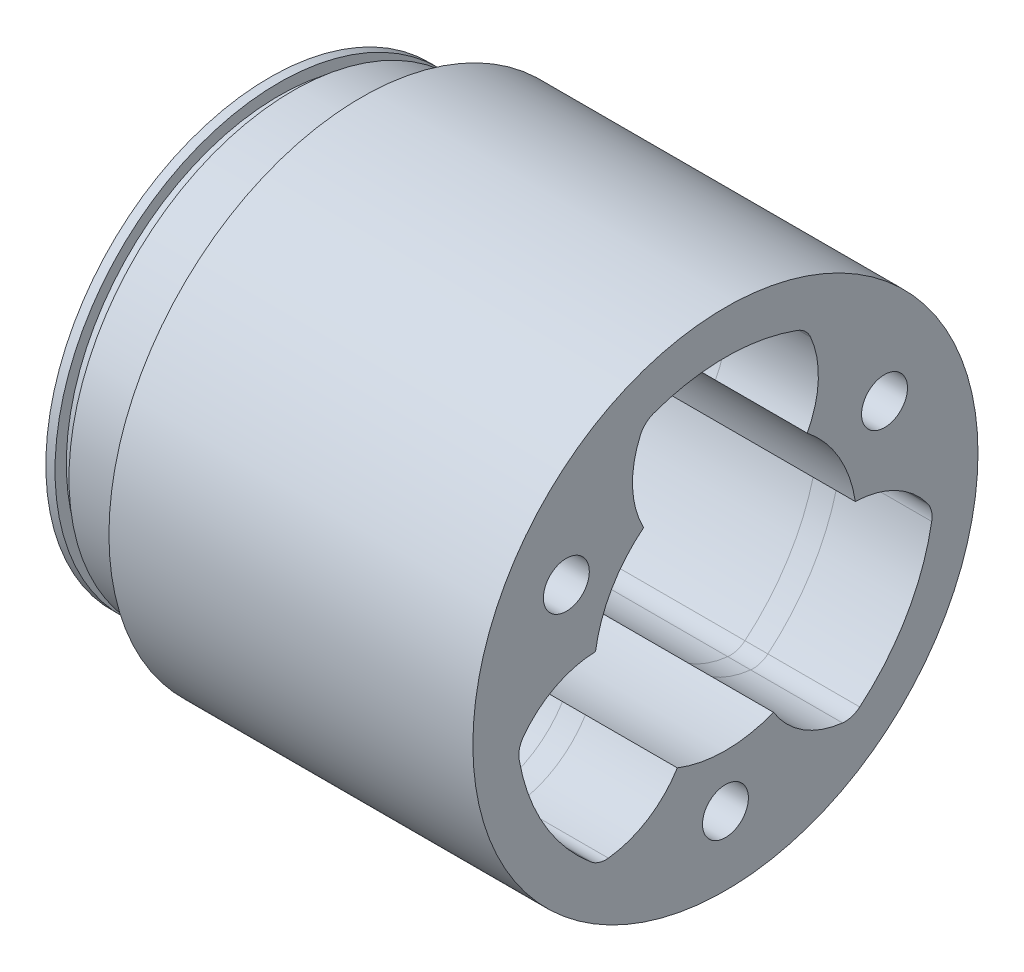
from build123d import *

# Parameters (mm, degrees)
SKETCH4_R                  = 34.925
SKETCH4_R_2                = 18.161
BOSS_EXTRUDE1_DEPTH        = 72.771
CUT_EXTRUDE2_REACH         = 137.172
CUT_EXTRUDE2_START         = 21.75002
TRIPOD_WALLS_R             = 3.175
SKETCH12_R                 = 3.175
CUT_EXTRUDE3_DEPTH         = 63.5
CUT_EXTRUDE4_START         = -22.44598
SKETCH13_R                 = 34.925
CUT_EXTRUDE4_DEPTH         = 22.44598
SKETCH16_R                 = 22.86
COMPENSATING_SPACING_DEPTH = 1.016
F_1_4_0_2500_DOWEL_HOLE1_D = 6.35
BOLT_CIRCLE_PATTERN_2_R    = 4.1021
F_5_16_CLEARNCE_DEPTH      = 13.716


with BuildPart() as part:
    # Sketch2 → Revolve1 (revolve)
    with BuildSketch(Plane.XY, mode=Mode.PRIVATE) as revolve1_sk:
        Polygon((0, 0), (0, -30.9499), (12.7, -30.9499), (12.7, 0), (3.2004, 0), (3.2004, -1.5621), (1.27, -1.5621), (1.27, 0), align=None)
    revolve(revolve1_sk.sketch.rotate(Axis((11.964521893, -30.9499, 0), (-1, 0, 0)), 90), axis=Axis((11.964521893, -30.9499, 0), (-1, 0, 0)))

    # Sketch4 → Boss-Extrude1 (add)
    with BuildSketch(Plane(origin=(12.7, 0, 0), x_dir=(0, 0, -1), z_dir=(1, 0, 0))):
        with Locations((0, -30.9499)):
            Circle(SKETCH4_R)
        with Locations((0, -30.9499)):
            Circle(SKETCH4_R_2, mode=Mode.SUBTRACT)
    extrude(amount=BOSS_EXTRUDE1_DEPTH)

    # Sketch5 → Cut-Extrude2 (cut, up to next)
    with BuildSketch(Plane(origin=(0, 0, 0), x_dir=(0, 0, -1), z_dir=(1, 0, 0)).offset(CUT_EXTRUDE2_START), mode=Mode.PRIVATE) as cut_extrude2_sk1:
        with BuildLine():
            ThreePointArc((-11.141810341, -4.2233215), (0, -23.4823), (11.141810341, -4.2233215))
            ThreePointArc((11.141810341, -4.2233215), (0, -1.9939), (-11.141810341, -4.2233215))
        make_face()
    cut_extrude2_tool1 = extrude(cut_extrude2_sk1.sketch, amount=CUT_EXTRUDE2_REACH, mode=Mode.PRIVATE) & part.part
    # Sketch5 → Cut-Extrude2 (cut, up to next)
    with BuildSketch(Plane(origin=(0, 0, 0), x_dir=(0, 0, -1), z_dir=(1, 0, 0)).offset(CUT_EXTRUDE2_START), mode=Mode.PRIVATE) as cut_extrude2_sk2:
        with BuildLine():
            ThreePointArc((-28.716801071, -34.664098733), (-25.076631449, -45.427900247), (-17.57499054, -53.962280223))
            ThreePointArc((-17.57499054, -53.962280223), (-6.467131268, -34.683700064), (-28.716801071, -34.664098733))
        make_face()
    cut_extrude2_tool2 = extrude(cut_extrude2_sk2.sketch, amount=CUT_EXTRUDE2_REACH, mode=Mode.PRIVATE) & part.part
    # Sketch5 → Cut-Extrude2 (cut, up to next)
    with BuildSketch(Plane(origin=(0, 0, 0), x_dir=(0, 0, -1), z_dir=(1, 0, 0)).offset(CUT_EXTRUDE2_START), mode=Mode.PRIVATE) as cut_extrude2_sk3:
        with BuildLine():
            ThreePointArc((28.716801071, -34.664098733), (6.467131268, -34.683700064), (17.57499054, -53.962280223))
            ThreePointArc((17.57499054, -53.962280223), (25.076631449, -45.427900247), (28.716801071, -34.664098733))
        make_face()
    cut_extrude2_tool3 = extrude(cut_extrude2_sk3.sketch, amount=CUT_EXTRUDE2_REACH, mode=Mode.PRIVATE) & part.part
    add(cut_extrude2_tool1.solids().sort_by_distance((21.75002, -12.135894, 0))[0], mode=Mode.SUBTRACT)
    add(cut_extrude2_tool2.solids().sort_by_distance((21.75002, -40.356903, 16.293407))[0], mode=Mode.SUBTRACT)
    add(cut_extrude2_tool3.solids().sort_by_distance((21.75002, -40.356903, -16.293407))[0], mode=Mode.SUBTRACT)

    # Tripod walls
    tripod_walls_edges = [part.edges().sort_by_distance(p)[0] for p in [
        (53.61051, -4.2233215, 11.141810341),
        (53.61051, -4.2233215, -11.141810341),
        (53.61051, -53.962280223, 17.57499054),
        (53.61051, -34.664098733, 28.716801071),
        (53.61051, -34.664098733, -28.716801071),
        (53.61051, -53.962280223, -17.57499054),
    ]]
    fillet(tripod_walls_edges, radius=TRIPOD_WALLS_R)

    # Sketch12 → Cut-Extrude3 (cut)
    with BuildSketch(Plane(origin=(85.471, 0, 0), x_dir=(0, 0, -1), z_dir=(1, 0, 0))):
        with Locations((-21.997045256, -18.2499)):
            Circle(SKETCH12_R)
        with Locations((21.997045256, -18.2499)):
            Circle(SKETCH12_R)
        with Locations((0, -56.3499)):
            Circle(SKETCH12_R)
    extrude(amount=-CUT_EXTRUDE3_DEPTH, mode=Mode.SUBTRACT)

    # Sketch13 → Cut-Extrude4 (cut)
    with BuildSketch(Plane(origin=(85.471, 0, 0), x_dir=(0, 0, -1), z_dir=(1, 0, 0)).offset(CUT_EXTRUDE4_START)):
        with Locations((0, -30.9499)):
            Circle(SKETCH13_R)
    extrude(amount=CUT_EXTRUDE4_DEPTH, mode=Mode.SUBTRACT)

    # Sketch16 → Compensating Spacing (add)
    with BuildSketch(Plane.ZY):
        with Locations(Location((0, -30.9499, 0), (0, 0, 270))):
            Circle(SKETCH16_R)
    extrude(amount=COMPENSATING_SPACING_DEPTH)

    # 1/4 (0.2500) Dowel Hole1 (through all)
    with Locations(Plane(origin=(12.7, 0, 0), x_dir=(0, 0, -1), z_dir=(1, 0, 0))):
        with Locations((0, -21.4249), (9.525, -30.9499), (0, -40.4749), (-9.525, -30.9499)):
            Hole(F_1_4_0_2500_DOWEL_HOLE1_D / 2)

    # Bolt Circle Pattern<2> → 5/16 Clearnce (cut)
    with BuildSketch(Plane(origin=(12.7, 0, 0), x_dir=(0, 0, -1), z_dir=(1, 0, 0))):
        with Locations((0, -30.9499)):
            Circle(BOLT_CIRCLE_PATTERN_2_R)
    extrude(amount=-F_5_16_CLEARNCE_DEPTH, mode=Mode.SUBTRACT)


solid = part.part
